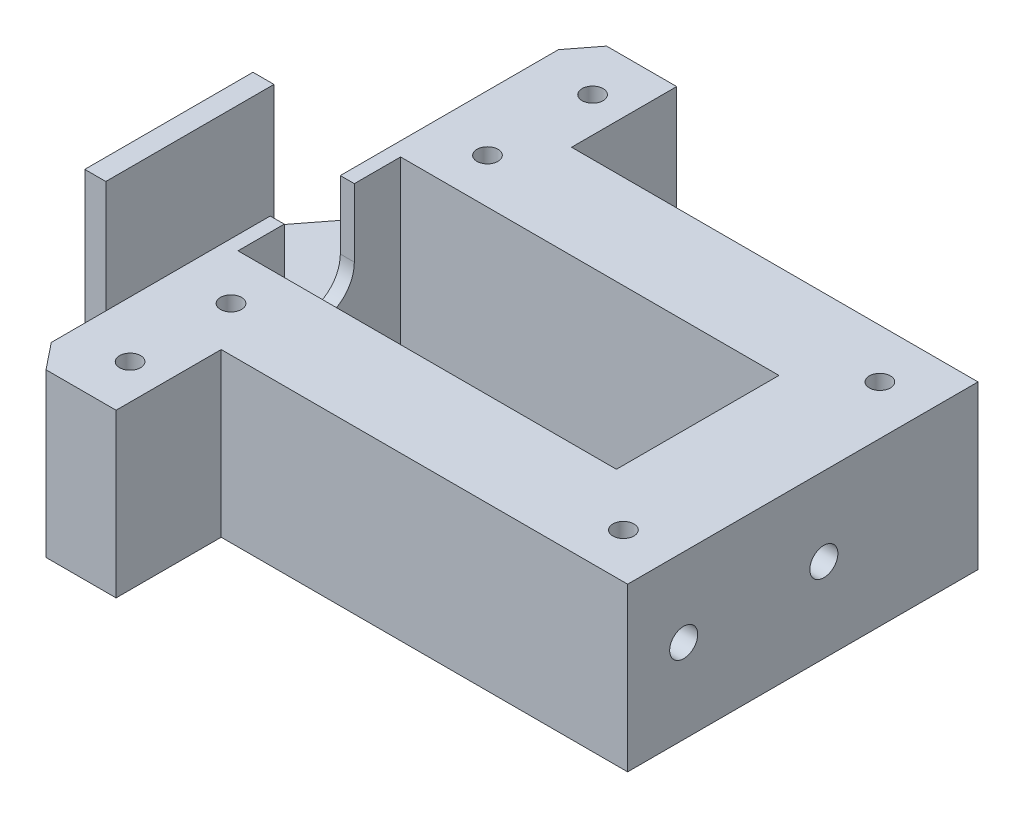
from build123d import *

# Parameters (mm, degrees)
BOSS_EXTRUDE1_DEPTH = 11.6
CUT_EXTRUDE1_DEPTH  = 9.55
SKETCH5_W           = 27
SKETCH5_H           = 11.6
CUT_EXTRUDE3_DEPTH  = 51.592094244
CUT_EXTRUDE4_DEPTH  = 3
CUT_EXTRUDE5_DEPTH  = 9.55
SKETCH8_R           = 1.26
CUT_EXTRUDE6_DEPTH  = 4
SKETCH9_W           = 29
SKETCH9_H           = 7.5
CUT_EXTRUDE7_DEPTH  = 51.592094244
SKETCH10_R          = 0.75
CUT_EXTRUDE8_DEPTH  = 4
SKETCH11_R          = 1
CUT_EXTRUDE9_DEPTH  = 4


with BuildPart() as part:
    # Sketch2 → Boss-Extrude1 (new body)
    with BuildSketch(Plane(origin=(0, 0, 0), x_dir=(1, 0, 0), z_dir=(0, 1, 0))):
        Polygon((0, 5.767018283), (0, -6.232981717), (11, -20), (45, -20), (45, 20), (11, 20), align=None)
    extrude(amount=BOSS_EXTRUDE1_DEPTH)

    # Sketch3 → Cut-Extrude1 (cut)
    with BuildSketch(Plane(origin=(0, 11.6, 0), x_dir=(1, 0, 0), z_dir=(0, 1, 0))):
        Polygon((1.5, 7.707879426), (1.5, -8.110302392), (9.5, -18.122679325), (9.5, 18.059138857), align=None)
    extrude(amount=-CUT_EXTRUDE1_DEPTH, mode=Mode.SUBTRACT)

    # Sketch5 → Cut-Extrude3 (cut, through all)
    with BuildSketch(Plane(origin=(0, 11.6, 0), x_dir=(1, 0, 0), z_dir=(0, 1, 0))):
        with Locations((24, 0)):
            Rectangle(SKETCH5_W, SKETCH5_H)
    extrude(amount=-CUT_EXTRUDE3_DEPTH, mode=Mode.SUBTRACT)

    # Sketch6 → Cut-Extrude4 (cut)
    with BuildSketch(Plane(origin=(10.5, 0, 0), x_dir=(0, 0, -1), z_dir=(1, 0, 0))):
        with BuildLine():
            Line((2.5, 6.75), (2.5, 11.6))
            Line((2.5, 11.6), (-2.5, 11.6))
            Line((-2.5, 11.6), (-2.5, 6.75))
            ThreePointArc((-2.5, 6.75), (0, 4.25), (2.5, 6.75))
        make_face()
    extrude(amount=-CUT_EXTRUDE4_DEPTH, mode=Mode.SUBTRACT)

    # Sketch7 → Cut-Extrude5 (cut)
    with BuildSketch(Plane(origin=(0, 11.6, 0), x_dir=(1, 0, 0), z_dir=(0, 1, 0))):
        Polygon((1.5, 7.707879426), (0, 5.767018283), (1.5, 5.767018283), align=None)
        Polygon((0, -6.232981717), (1.5, -6.232981717), (1.5, -8.110302392), align=None)
    extrude(amount=-CUT_EXTRUDE5_DEPTH, mode=Mode.SUBTRACT)

    # Sketch8 → Cut-Extrude6 (cut)
    with BuildSketch(Plane.XZ):
        with Locations(Location((30.5, 9.89, 0), (0, 0, 270))):
            Circle(SKETCH8_R)
        with Locations(Location((30.5, -9.89, 0), (0, 0, 270))):
            Circle(SKETCH8_R)
    extrude(amount=-CUT_EXTRUDE6_DEPTH, mode=Mode.SUBTRACT)

    # Sketch9 → Cut-Extrude7 (cut, through all)
    with BuildSketch(Plane.XZ):
        with Locations((30.5, 16.25)):
            Rectangle(SKETCH9_W, SKETCH9_H)
        with Locations((30.5, -16.25)):
            Rectangle(SKETCH9_W, SKETCH9_H)
    extrude(amount=-CUT_EXTRUDE7_DEPTH, mode=Mode.SUBTRACT)

    # Sketch10 → Cut-Extrude8 (cut)
    with BuildSketch(Plane(origin=(0, 11.6, 0), x_dir=(1, 0, 0), z_dir=(0, 1, 0))):
        with Locations(Location((13.5, 16.5, 0), (0, 0, 270))):
            Circle(SKETCH10_R)
        with Locations(Location((13.5, 9, 0), (0, 0, 270))):
            Circle(SKETCH10_R)
        with Locations(Location((41.5, 9, 0), (0, 0, 270))):
            Circle(SKETCH10_R)
        with Locations(Location((41.5, -9.3, 0), (0, 0, 270))):
            Circle(SKETCH10_R)
        with Locations(Location((13.5, -9.3, 0), (0, 0, 270))):
            Circle(SKETCH10_R)
        with Locations(Location((13.5, -16.5, 0), (0, 0, 270))):
            Circle(SKETCH10_R)
    extrude(amount=-CUT_EXTRUDE8_DEPTH, mode=Mode.SUBTRACT)

    # Sketch11 → Cut-Extrude9 (cut)
    with BuildSketch(Plane(origin=(45, 0, 0), x_dir=(0, 0, -1), z_dir=(1, 0, 0))):
        with Locations((-8.5, 6)):
            Circle(SKETCH11_R)
        with Locations((1.5, 6)):
            Circle(SKETCH11_R)
    extrude(amount=-CUT_EXTRUDE9_DEPTH, mode=Mode.SUBTRACT)


solid = part.part
